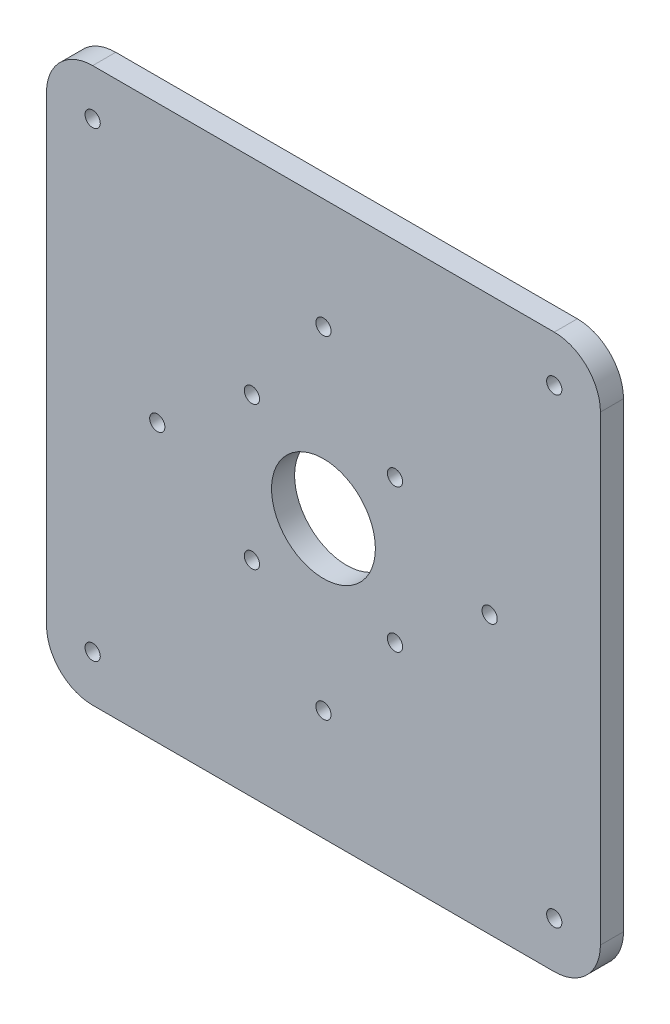
from build123d import *

# Parameters (mm, degrees)
PLASTINA_DEPTH        = 5
OTVERSTIYA_DEPTH      = 86
OTVERSTIYA_DEPTH_BACK = 86
ESKIZ_OTVERSTIYA_R    = 1.65
ESKIZ_OTVERSTIYA_R_2  = 11.25


with BuildPart() as part:
    # Eskiz_kontur → Plastina (new body)
    with BuildSketch(Plane.XY):
        with BuildLine():
            Line((-60, -50), (-60, 50))
            ThreePointArc((-60, 50), (-57.071067812, 57.071067812), (-50, 60))
            Line((-50, 60), (50, 60))
            ThreePointArc((50, 60), (57.071067812, 57.071067812), (60, 50))
            Line((60, 50), (60, -50))
            ThreePointArc((60, -50), (57.071067812, -57.071067812), (50, -60))
            Line((50, -60), (-50, -60))
            ThreePointArc((-50, -60), (-57.071067812, -57.071067812), (-60, -50))
        make_face()
    extrude(amount=PLASTINA_DEPTH)

    # Eskiz_otverstiya → Otverstiya (cut, two sides: drawn at the far end of the back side and taken through both)
    with BuildSketch(Plane.XY.offset(-OTVERSTIYA_DEPTH_BACK)):
        with Locations((-50, -50)):
            Circle(ESKIZ_OTVERSTIYA_R)
        with Locations((0, -36)):
            Circle(ESKIZ_OTVERSTIYA_R)
        with Locations((-15.5, -15.5)):
            Circle(ESKIZ_OTVERSTIYA_R)
        Circle(ESKIZ_OTVERSTIYA_R_2)
        with Locations((50, -50)):
            Circle(ESKIZ_OTVERSTIYA_R)
        with Locations((15.5, -15.5)):
            Circle(ESKIZ_OTVERSTIYA_R)
        with Locations((36, 0)):
            Circle(ESKIZ_OTVERSTIYA_R)
        with Locations((-36, 0)):
            Circle(ESKIZ_OTVERSTIYA_R)
        with Locations((-15.5, 15.5)):
            Circle(ESKIZ_OTVERSTIYA_R)
        with Locations((-50, 50)):
            Circle(ESKIZ_OTVERSTIYA_R)
        with Locations((0, 36)):
            Circle(ESKIZ_OTVERSTIYA_R)
        with Locations((15.5, 15.5)):
            Circle(ESKIZ_OTVERSTIYA_R)
        with Locations((50, 50)):
            Circle(ESKIZ_OTVERSTIYA_R)
    extrude(amount=OTVERSTIYA_DEPTH + OTVERSTIYA_DEPTH_BACK, mode=Mode.SUBTRACT)


solid = part.part
